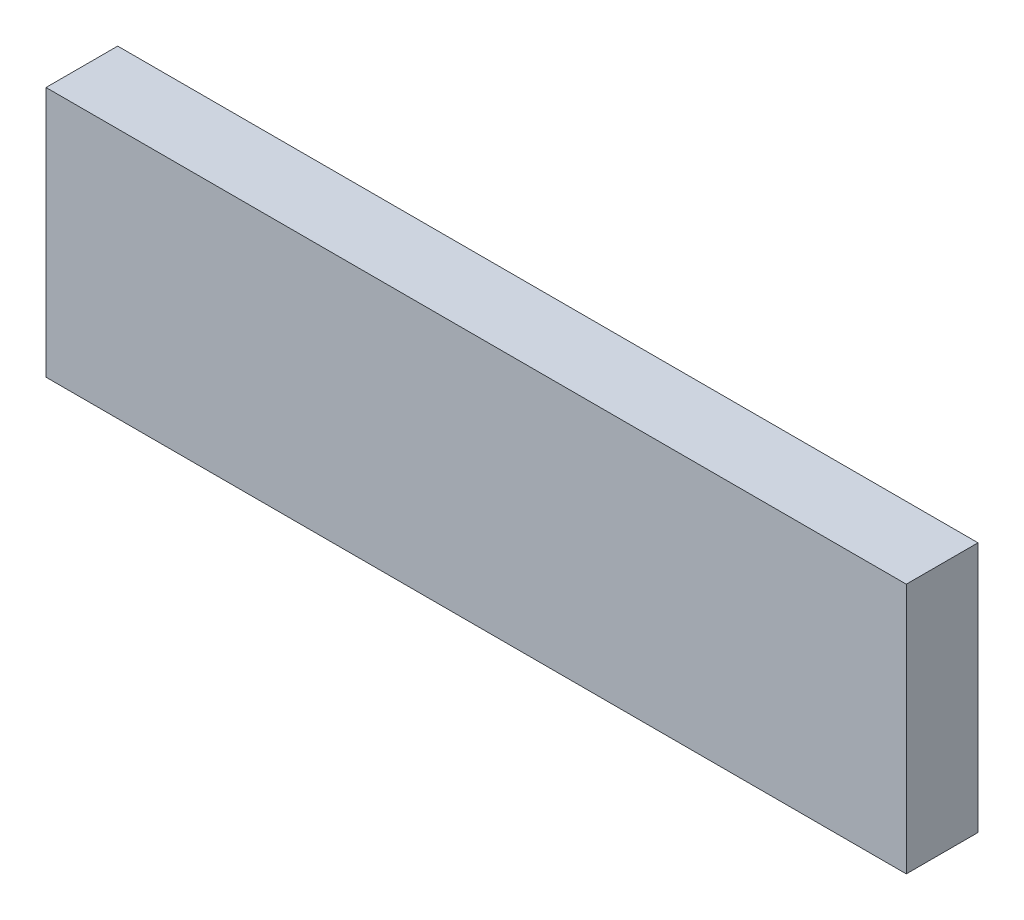
from build123d import *

# Parameters (mm, degrees)
SKETCH_1_W      = 240
SKETCH_1_H      = 70
EXTRUDE_1_DEPTH = 20


with BuildPart() as part:
    # 草图1 → 凸台-拉伸1 (new body)
    with BuildSketch(Plane.XY):
        Rectangle(SKETCH_1_W, SKETCH_1_H)
    extrude(amount=EXTRUDE_1_DEPTH)


solid = part.part
